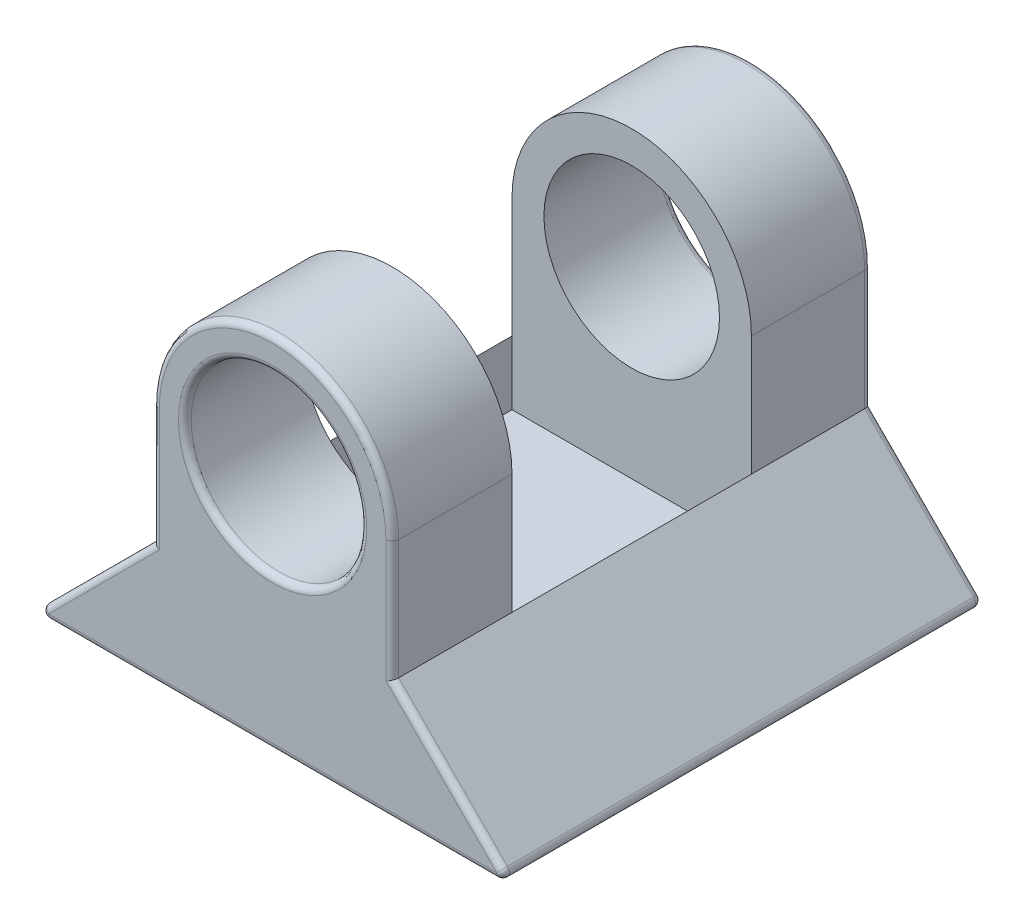
from build123d import *

# Parameters (mm, degrees)
EXTRUDE_1_DEPTH                 = 7.5
EXTRUDE_1_DEPTH_BACK            = 7.5
SKETCH_1_R                      = 2.75
CUT_EXTRUDE_1_DEPTH             = 3.75
CUT_EXTRUDE_1_DEPTH_BACK        = 3.75
SKETCH_2_W                      = 7.5
SKETCH_2_H                      = 8.25
SKETCH_3_W                      = 7.5
SKETCH_3_H                      = 7.5
CUT_EXTRUDE_2_DEPTH             = 2
SKETCH_4_W                      = 3
SKETCH_4_H                      = 3
EXTRUDE_2_DEPTH                 = 1
EXTRUDE_3_DEPTH                 = 2
EXTRUDE_3_DEPTH_BACK            = 2
CUT_EXTRUDE_3_REACH             = 17.462
CUT_EXTRUDE_3_DIRECTION_2_REACH = 17.462
FILLET_1_R                      = 0.1
FILLET_2_R                      = 0.2


with BuildPart() as part:
    # 草图1 → 凸台-拉伸1 (new, two sides: drawn at the far end of the back side and taken through both)
    with BuildSketch(Plane.XY.offset(-EXTRUDE_1_DEPTH_BACK)):
        with BuildLine():
            Line((-7.5, 0), (7.5, 0))
            Line((7.5, 0), (3.75, 3.75))
            Line((3.75, 3.75), (3.75, 7.5))
            ThreePointArc((3.75, 7.5), (0, 11.25), (-3.75, 7.5))
            Line((-3.75, 7.5), (-3.75, 3.75))
            Line((-3.75, 3.75), (-7.5, 0))
        make_face()
        with Locations((0, 7.5)):
            Circle(SKETCH_1_R, mode=Mode.SUBTRACT)
    extrude(amount=EXTRUDE_1_DEPTH + EXTRUDE_1_DEPTH_BACK)

    # 草图2 → 切除-拉伸1 (cut, two sides: drawn at the far end of the back side and taken through both)
    with BuildSketch(Plane.XY.offset(-CUT_EXTRUDE_1_DEPTH_BACK)):
        with Locations((0, 7.875)):
            Rectangle(SKETCH_2_W, SKETCH_2_H)
    extrude(amount=CUT_EXTRUDE_1_DEPTH + CUT_EXTRUDE_1_DEPTH_BACK, mode=Mode.SUBTRACT)

    # 草图3 → 切除-拉伸2 (cut)
    with BuildSketch(Plane(origin=(0, 3.75, 0), x_dir=(-1, 0, 0), z_dir=(0, 1, 0))):
        Rectangle(SKETCH_3_W, SKETCH_3_H)
    extrude(amount=-CUT_EXTRUDE_2_DEPTH, mode=Mode.SUBTRACT)

    # 草图4 → 凸台-拉伸2 (add)
    with BuildSketch(Plane.XZ):
        Rectangle(SKETCH_4_W, SKETCH_4_H)
    extrude(amount=EXTRUDE_2_DEPTH)

    # 草图5 → 凸台-拉伸3 (add, two sides: drawn at the far end of the back side and taken through both)
    with BuildSketch(Plane.XY.offset(-EXTRUDE_3_DEPTH_BACK)):
        with BuildLine():
            Line((-1.95, -2.5), (1.95, -2.5))
            Line((1.95, -2.5), (1.95, -1.555590279))
            ThreePointArc((1.95, -1.555590279), (1.780042303, -1.088161527), (1.5, -0.677124344))
            Line((1.5, -0.677124344), (-1.5, -0.677124344))
            ThreePointArc((-1.5, -0.677124344), (-1.780042303, -1.088161527), (-1.95, -1.555590279))
            Line((-1.95, -1.555590279), (-1.95, -2.5))
        make_face()
    extrude(amount=EXTRUDE_3_DEPTH + EXTRUDE_3_DEPTH_BACK)

    # 草图6 → 切除-拉伸3 (cut, up to next)
    with BuildSketch(Plane(origin=(0, 0, 0), x_dir=(0, 0, -1), z_dir=(1, 0, 0)), mode=Mode.PRIVATE) as cut_extrude_3_sk1:
        with BuildLine():
            Line((1.95, -2.5), (1.95, -1.555590279))
            ThreePointArc((1.95, -1.555590279), (1.780042303, -1.088161527), (1.5, -0.677124344))
            Line((1.5, -0.677124344), (2, -0.677124344))
            Line((2, -0.677124344), (2, -2.5))
            Line((2, -2.5), (1.95, -2.5))
        make_face()
    cut_extrude_3_tool1 = extrude(cut_extrude_3_sk1.sketch, amount=-CUT_EXTRUDE_3_REACH, mode=Mode.PRIVATE) & part.part
    # 草图6 → 切除-拉伸3 (cut, up to next)
    with BuildSketch(Plane(origin=(0, 0, 0), x_dir=(0, 0, -1), z_dir=(1, 0, 0)), mode=Mode.PRIVATE) as cut_extrude_3_sk2:
        with BuildLine():
            Line((-2, -2.5), (-2, -0.677124344))
            Line((-2, -0.677124344), (-1.5, -0.677124344))
            ThreePointArc((-1.5, -0.677124344), (-1.780042303, -1.088161527), (-1.95, -1.555590279))
            Line((-1.95, -1.555590279), (-1.95, -2.5))
            Line((-1.95, -2.5), (-2, -2.5))
        make_face()
    cut_extrude_3_tool2 = extrude(cut_extrude_3_sk2.sketch, amount=-CUT_EXTRUDE_3_REACH, mode=Mode.PRIVATE) & part.part
    add(cut_extrude_3_tool1.solids().sort_by_distance((0, -1.175075, -1.873038))[0], mode=Mode.SUBTRACT)
    add(cut_extrude_3_tool2.solids().sort_by_distance((0, -1.175075, 1.873038))[0], mode=Mode.SUBTRACT)

    # 草图6 → 切除-拉伸3 direction 2 (cut, up to next)
    with BuildSketch(Plane(origin=(0, 0, 0), x_dir=(0, 0, -1), z_dir=(1, 0, 0)), mode=Mode.PRIVATE) as cut_extrude_3_direction_2_sk1:
        with BuildLine():
            Line((1.95, -2.5), (1.95, -1.555590279))
            ThreePointArc((1.95, -1.555590279), (1.780042303, -1.088161527), (1.5, -0.677124344))
            Line((1.5, -0.677124344), (2, -0.677124344))
            Line((2, -0.677124344), (2, -2.5))
            Line((2, -2.5), (1.95, -2.5))
        make_face()
    cut_extrude_3_direction_2_tool1 = extrude(cut_extrude_3_direction_2_sk1.sketch, amount=CUT_EXTRUDE_3_DIRECTION_2_REACH, mode=Mode.PRIVATE) & part.part
    # 草图6 → 切除-拉伸3 direction 2 (cut, up to next)
    with BuildSketch(Plane(origin=(0, 0, 0), x_dir=(0, 0, -1), z_dir=(1, 0, 0)), mode=Mode.PRIVATE) as cut_extrude_3_direction_2_sk2:
        with BuildLine():
            Line((-2, -2.5), (-2, -0.677124344))
            Line((-2, -0.677124344), (-1.5, -0.677124344))
            ThreePointArc((-1.5, -0.677124344), (-1.780042303, -1.088161527), (-1.95, -1.555590279))
            Line((-1.95, -1.555590279), (-1.95, -2.5))
            Line((-1.95, -2.5), (-2, -2.5))
        make_face()
    cut_extrude_3_direction_2_tool2 = extrude(cut_extrude_3_direction_2_sk2.sketch, amount=CUT_EXTRUDE_3_DIRECTION_2_REACH, mode=Mode.PRIVATE) & part.part
    add(cut_extrude_3_direction_2_tool1.solids().sort_by_distance((0, -1.175075, -1.873038))[0], mode=Mode.SUBTRACT)
    add(cut_extrude_3_direction_2_tool2.solids().sort_by_distance((0, -1.175075, 1.873038))[0], mode=Mode.SUBTRACT)

    # 圆角1
    fillet_1_edges = [part.edges().sort_by_distance(p)[0] for p in [
        (0, -2.5, -1.95),
        (-1.95, -2.5, 0),
        (0, -2.5, 1.95),
        (1.95, -2.5, 0),
    ]]
    fillet(fillet_1_edges, radius=FILLET_1_R)

    # 圆角2
    fillet_2_edges = [part.edges().sort_by_distance(p)[0] for p in [
        (-2.75, 7.5, 7.5),
        (0, 0, 7.5),
        (-5.625, 1.875, 7.5),
        (-3.75, 5.625, 7.5),
        (0, 11.25, 7.5),
        (3.75, 5.625, 7.5),
        (5.625, 1.875, 7.5),
        (3.75, 5.625, -7.5),
        (0, 11.25, -7.5),
        (-3.75, 5.625, -7.5),
        (-5.625, 1.875, -7.5),
        (0, 0, -7.5),
        (5.625, 1.875, -7.5),
        (-2.75, 7.5, -7.5),
        (-7.5, 0, 0),
        (7.5, 0, 0),
    ]]
    fillet(fillet_2_edges, radius=FILLET_2_R)


solid = part.part
